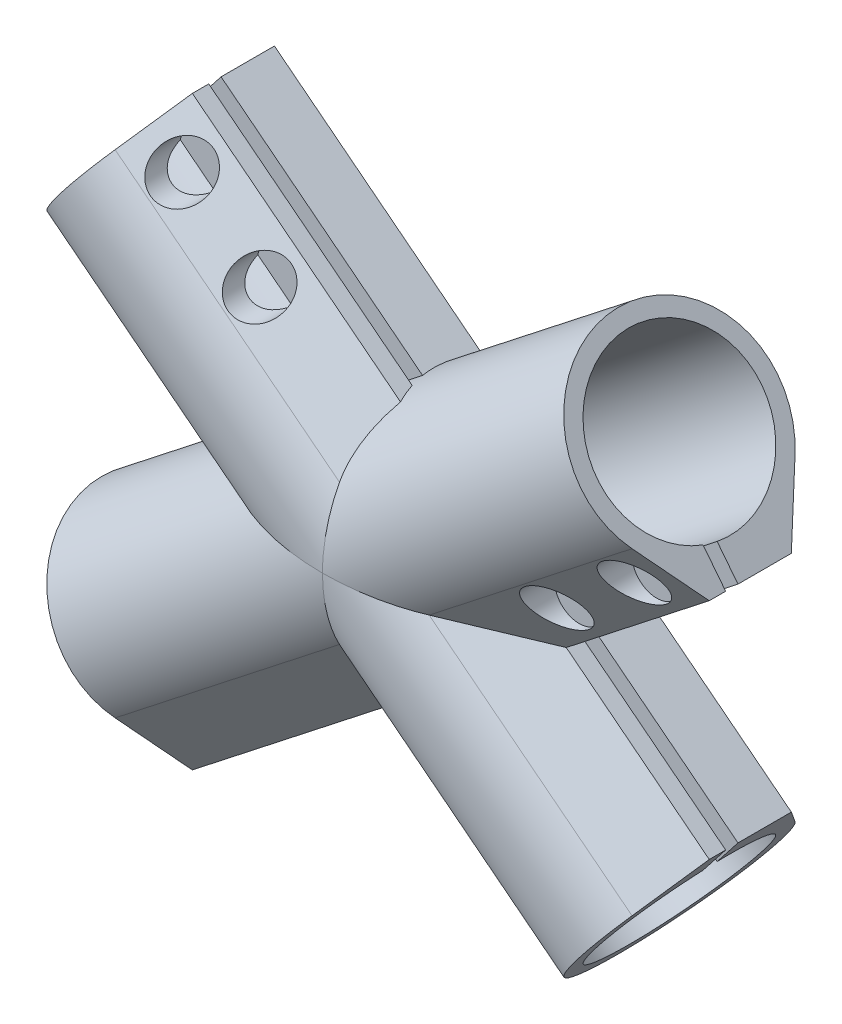
from build123d import *

# Parameters (mm, degrees)
BOSS_EXTRU_1_DEPTH      = 80
BOSS_EXTRU_2_DEPTH      = 80
ESQUISSE6_R             = 10
ENL_V_MAT_EXTRU_1_DEPTH = 94.48690022224822
ESQUISSE7_R             = 10.000000000000004
ENL_V_MAT_EXTRU_2_DEPTH = 94.48690022224821
ENL_V_START             = -2
ESQUISSE8_R             = 2.9999999999999973
ESQUISSE8_R_2           = 3.0000000000000004
ENL_V_MAT_EXTRU_3_DEPTH = 10


with BuildPart() as part:
    # Esquisse4 → Boss.-Extru.1 (new body)
    with BuildSketch(Plane(origin=(31.486834784070687, 24.669398762041954, 0), x_dir=(0, 0, 1), z_dir=(-0.7871708696017671, -0.6167349690510487, 0))):
        with BuildLine():
            Line((-9.92847971530262, -6.739828673106199), (-5.000000000000012, -13.999999999999998))
            Line((-5.000000000000012, -13.999999999999998), (1.4999999999999891, -14.000000000000004))
            Line((1.4999999999999891, -14.000000000000004), (1.4999999999999891, -9.886859966642595))
            ThreePointArc((1.4999999999999891, -9.886859966642595), (-2.2566974751833473, 9.742038621638756), (2.9999999999999933, -9.539392014169461))
            Line((2.9999999999999933, -9.539392014169461), (2.999999999999988, -14.000000000000005))
            Line((2.999999999999988, -14.000000000000005), (4.999999999999987, -14.000000000000009))
            Line((4.999999999999987, -14.000000000000009), (9.928479715302606, -6.739828673106216))
            ThreePointArc((9.928479715302606, -6.739828673106216), (1.807e-14, 12), (-9.92847971530262, -6.739828673106199))
        make_face()
    extrude(amount=BOSS_EXTRU_1_DEPTH)

    # Esquisse5 → Boss.-Extru.2 (add)
    with BuildSketch(Plane(origin=(31.48683478407068, -24.66939876204195, 0), x_dir=(0, 0, -1), z_dir=(0.7871708696017671, -0.6167349690510487, 0))):
        with BuildLine():
            Line((9.9284797153026, 6.7398286731062225), (4.999999999999976, 14.000000000000009))
            Line((4.999999999999976, 14.000000000000009), (-1.5000000000000255, 13.999999999999995))
            Line((-1.5000000000000255, 13.999999999999995), (-1.5000000000000149, 9.88685996664259))
            ThreePointArc((-1.5000000000000149, 9.88685996664259), (2.256697475183369, -9.742038621638747), (-3.0000000000000173, 9.53939201416945))
            Line((-3.0000000000000173, 9.53939201416945), (-3.0000000000000244, 13.999999999999996))
            Line((-3.0000000000000244, 13.999999999999996), (-5.000000000000023, 13.999999999999991))
            Line((-5.000000000000023, 13.999999999999991), (-9.928479715302622, 6.739828673106189))
            ThreePointArc((-9.928479715302622, 6.739828673106189), (1.777e-14, -11.999999999999998), (9.9284797153026, 6.7398286731062225))
        make_face()
    extrude(amount=-BOSS_EXTRU_2_DEPTH)

    # Esquisse6 → Enlèv. mat.-Extru.1 (cut, through all)
    with BuildSketch(Plane(origin=(31.486834784070695, 24.669398762041958, 0), x_dir=(0, 0, -1), z_dir=(0.7871708696017669, 0.6167349690510489, 0))):
        with Locations(Location((0, 6.94e-15, 0), (0, 0, 252.542396876))):
            Circle(ESQUISSE6_R)
    extrude(amount=-ENL_V_MAT_EXTRU_1_DEPTH, mode=Mode.SUBTRACT)

    # Esquisse7 → Enlèv. mat.-Extru.2 (cut, through all)
    with BuildSketch(Plane(origin=(31.486834784070687, -24.669398762041954, 0), x_dir=(0, 0, -1), z_dir=(0.7871708696017669, -0.6167349690510489, 0))):
        with Locations(Location((0, -6.94e-15, 0), (0, 0, 98.626926559))):
            Circle(ESQUISSE7_R)
    extrude(amount=-ENL_V_MAT_EXTRU_2_DEPTH, mode=Mode.SUBTRACT)

    # Esquisse8 → Enlèv. mat.-Extru.3 (cut)
    with BuildSketch(Plane(origin=(5e-17, -5.97e-15, 2.999999999999953), x_dir=(-1, 0, 2e-17), z_dir=(-2e-17, 1.99e-15, -1)).offset(ENL_V_START)):
        with Locations(Location((21.383630745551354, 29.45743261280437, 0), (0, 0, 128.078094677))):
            Circle(ESQUISSE8_R)
        with Locations(Location((11.937580310330151, 22.056612984191787, 0), (0, 0, 128.078094677))):
            Circle(ESQUISSE8_R_2)
        with Locations(Location((-24.272279691351134, 6.31319559215644, 0), (0, 0, 115.397306959))):
            Circle(ESQUISSE8_R)
        with Locations(Location((-33.71833012657233, 13.714015220769031, 0), (0, 0, 115.397306959))):
            Circle(ESQUISSE8_R_2)
    extrude(amount=-ENL_V_MAT_EXTRU_3_DEPTH, mode=Mode.SUBTRACT)


solid = part.part
